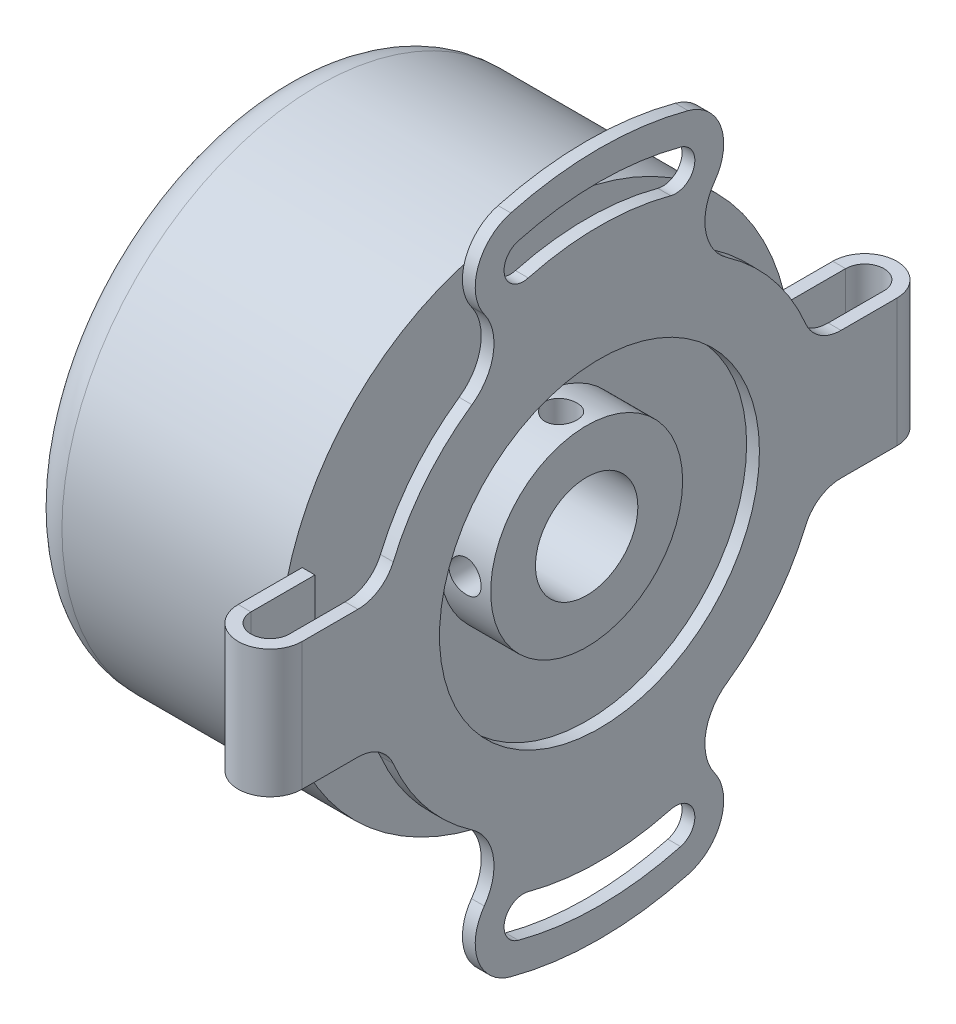
from build123d import *

# Parameters (mm, degrees)
SKETCH1_R                           = 20
BOSS_EXTRUDE1_DEPTH                 = 20
FILLET1_R                           = 3
SKETCH2_R                           = 7.5
BOSS_EXTRUDE2_DEPTH                 = 4
M3X0_5_TAPPED_HOLE1_D               = 2.5
M3X0_5_TAPPED_HOLE1_DEPTH           = 7.5
M3X0_5_TAPPED_HOLE1_TIP             = 0.751075774
M3X0_5_TAPPED_HOLE1_ON_FACE_2_D     = 2.5
M3X0_5_TAPPED_HOLE1_ON_FACE_2_DEPTH = 7.5
M3X0_5_TAPPED_HOLE1_ON_FACE_2_TIP   = 0.751075774
SKETCH5_R                           = 4
CUT_EXTRUDE1_DEPTH                  = 38.09447409
SKETCH6_R                           = 12.5
BOSS_EXTRUDE3_DEPTH                 = 1
FILLET2_R                           = 3
SKETCH35_W                          = 1
SKETCH35_H                          = 10


with BuildPart() as part:
    # Sketch1 → Boss-Extrude1 (new body)
    with BuildSketch(Plane(origin=(0, 0, 0), x_dir=(0, 0, -1), z_dir=(1, 0, 0))):
        Circle(SKETCH1_R)
    extrude(amount=BOSS_EXTRUDE1_DEPTH)

    # Fillet1
    fillet1_edges = [part.edges().sort_by_distance(p)[0] for p in [
        (0, 0, 20),
    ]]
    fillet(fillet1_edges, radius=FILLET1_R)

    # Sketch2 → Boss-Extrude2 (add)
    with BuildSketch(Plane(origin=(20, 0, 0), x_dir=(0, 0, -1), z_dir=(1, 0, 0))):
        Circle(SKETCH2_R)
    extrude(amount=BOSS_EXTRUDE2_DEPTH)

    # M3x0.5 Tapped Hole1
    with Locations(Plane(origin=(22.000008994, -7.4235e-05, 7.5), x_dir=(0, 0.999999999951, 9.89804e-06), z_dir=(0, -9.89804e-06, 0.999999999951))):
        with Locations((0, 0)):
            Hole(M3X0_5_TAPPED_HOLE1_D / 2, depth=M3X0_5_TAPPED_HOLE1_DEPTH)
            with Locations((0, 0, -(M3X0_5_TAPPED_HOLE1_DEPTH + M3X0_5_TAPPED_HOLE1_TIP / 2))):  # 118° drill point
                Cone(0, M3X0_5_TAPPED_HOLE1_D / 2, M3X0_5_TAPPED_HOLE1_TIP, mode=Mode.SUBTRACT)

    # M3x0.5 Tapped Hole1 on face 2
    with Locations(Plane(origin=(22.001585242, 7.499999998, -0.000151303), x_dir=(0, 2e-05, 0.9999999998), z_dir=(0, 0.9999999998, -2e-05))):
        with Locations((0, 0)):
            Hole(M3X0_5_TAPPED_HOLE1_ON_FACE_2_D / 2, depth=M3X0_5_TAPPED_HOLE1_ON_FACE_2_DEPTH)
            with Locations((0, 0, -(M3X0_5_TAPPED_HOLE1_ON_FACE_2_DEPTH + M3X0_5_TAPPED_HOLE1_ON_FACE_2_TIP / 2))):  # 118° drill point
                Cone(0, M3X0_5_TAPPED_HOLE1_ON_FACE_2_D / 2, M3X0_5_TAPPED_HOLE1_ON_FACE_2_TIP, mode=Mode.SUBTRACT)

    # Sketch5 → Cut-Extrude1 (cut, through all)
    with BuildSketch(Plane(origin=(24, 0, 0), x_dir=(0, 0, -1), z_dir=(1, 0, 0))):
        Circle(SKETCH5_R)
    extrude(amount=-CUT_EXTRUDE1_DEPTH, mode=Mode.SUBTRACT)


with BuildPart() as body_2:
    # Sketch6 → Boss-Extrude3 (new body)
    with BuildSketch(Plane(origin=(25, 0, 0), x_dir=(0, 0, -1), z_dir=(1, 0, 0))):
        with BuildLine():
            Line((-23.230409619, -5), (-16.770509831, -5))
            ThreePointArc((-16.770509831, -5), (-14.166860207, -10.273756463), (-9.963037767, -14.387073311))
            ThreePointArc((-9.963037767, -14.387073311), (-8.297848841, -16.999491792), (-8.997537544, -20.01744146))
            ThreePointArc((-8.997537544, -20.01744146), (-9.49130688, -23.475017902), (-6.924880077, -25.844004284))
            ThreePointArc((-6.924880077, -25.844004284), (0, -26.755682042), (6.924880077, -25.844004284))
            ThreePointArc((6.924880077, -25.844004284), (9.49130688, -23.475017902), (8.997537544, -20.01744146))
            ThreePointArc((8.997537544, -20.01744146), (8.297848841, -16.999491792), (9.963037767, -14.387073311))
            ThreePointArc((9.963037767, -14.387073311), (14.166860207, -10.273756463), (16.770509831, -5))
            Line((16.770509831, -5), (23.230409619, -5))
            Line((23.230409619, -5), (23.230409619, 5))
            Line((23.230409619, 5), (16.770509831, 5))
            ThreePointArc((16.770509831, 5), (14.166860207, 10.273756463), (9.963037767, 14.387073311))
            ThreePointArc((9.963037767, 14.387073311), (8.297848841, 16.999491792), (8.997537544, 20.01744146))
            ThreePointArc((8.997537544, 20.01744146), (9.49130688, 23.475017902), (6.924880077, 25.844004284))
            ThreePointArc((6.924880077, 25.844004284), (0, 26.755682042), (-6.924880077, 25.844004284))
            ThreePointArc((-6.924880077, 25.844004284), (-9.49130688, 23.475017902), (-8.997537544, 20.01744146))
            ThreePointArc((-8.997537544, 20.01744146), (-8.297848841, 16.999491792), (-9.963037767, 14.387073311))
            ThreePointArc((-9.963037767, 14.387073311), (-14.166860207, 10.273756463), (-16.770509831, 5))
            Line((-16.770509831, 5), (-23.230409619, 5))
            Line((-23.230409619, 5), (-23.230409619, -5))
        make_face()
        Circle(SKETCH6_R, mode=Mode.SUBTRACT)
        with BuildLine():
            ThreePointArc((5.56460947, 20.767405265), (0, 21.5), (-5.56460947, 20.767405265))
            ThreePointArc((-5.56460947, 20.767405265), (-7.401726777, 21.828065437), (-6.341066605, 23.665182744))
            ThreePointArc((-6.341066605, 23.665182744), (0, 24.5), (6.341066605, 23.665182744))
            ThreePointArc((6.341066605, 23.665182744), (7.401726777, 21.828065437), (5.56460947, 20.767405265))
        make_face(mode=Mode.SUBTRACT)
        with BuildLine():
            ThreePointArc((5.56460947, -20.767405265), (0, -21.5), (-5.56460947, -20.767405265))
            ThreePointArc((-5.56460947, -20.767405265), (-7.401726777, -21.828065437), (-6.341066605, -23.665182744))
            ThreePointArc((-6.341066605, -23.665182744), (0, -24.5), (6.341066605, -23.665182744))
            ThreePointArc((6.341066605, -23.665182744), (7.401726777, -21.828065437), (5.56460947, -20.767405265))
        make_face(mode=Mode.SUBTRACT)
    extrude(amount=-BOSS_EXTRUDE3_DEPTH)

    # Fillet2
    fillet2_edges = [body_2.edges().sort_by_distance(p)[0] for p in [
        (24.5, 5, 16.770509831),
        (24.5, 5, -16.770509831),
        (24.5, -5, -16.770509831),
        (24.5, -5, 16.770509831),
    ]]
    fillet(fillet2_edges, radius=FILLET2_R)

    # Sweep2: sweep along a path in Sketch20
    with BuildLine(Plane(origin=(0, 0, 0), x_dir=(1, 0, 0), z_dir=(0, 1, 0))) as sweep2_path:
        Line((20.5, -18.230409619), (20.5, -23.230409619))
        ThreePointArc((20.5, -23.230409619), (22.5, -25.230409619), (24.5, -23.230409619))
    # Sketch35 → Sweep2 (sweep)
    with BuildSketch(Plane.XY.offset(23.230409619)):
        with Locations((24.5, 0)):
            Rectangle(SKETCH35_W, SKETCH35_H)
    sweep2 = sweep(path=sweep2_path.line)

    # Mirror1: Sweep2 across plane
    add(sweep2.mirror(Plane.XY))


solid = Compound([part.part, body_2.part])
